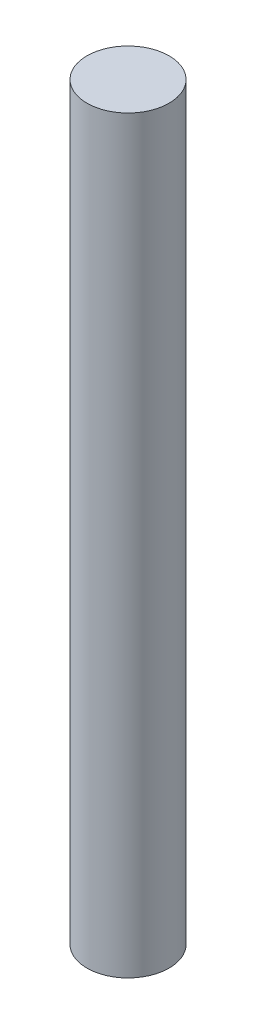
from build123d import *

# Parameters (mm, degrees)
SKETCH1_R           = 1.59
BOSS_EXTRUDE1_DEPTH = 29


with BuildPart() as part:
    # Sketch1 → Boss-Extrude1 (new body)
    with BuildSketch(Plane(origin=(0, 0, 0), x_dir=(1, 0, 0), z_dir=(0, 1, 0))):
        with Locations(Location((0, 0, 0), (0, 0, 90))):
            Circle(SKETCH1_R)
    extrude(amount=BOSS_EXTRUDE1_DEPTH)


solid = part.part
